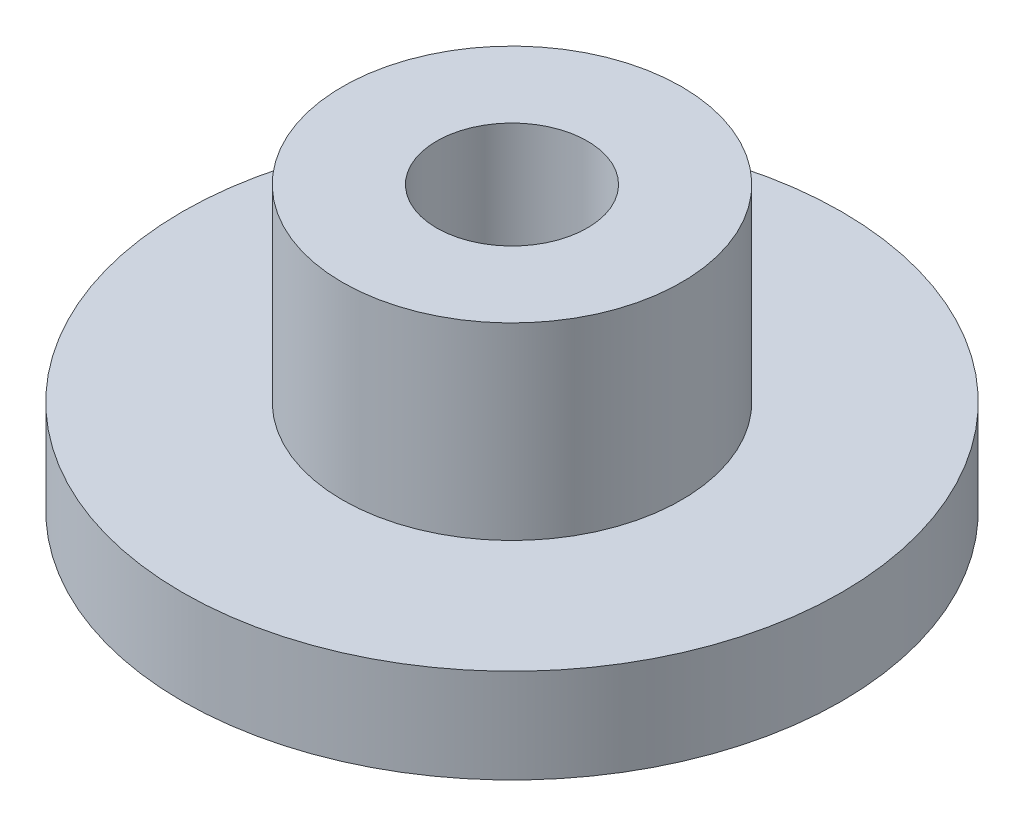
from build123d import *

# Parameters (mm, degrees)
SKETCH1_R           = 17.5
SKETCH1_R_2         = 2.5
BOSS_EXTRUDE1_DEPTH = 5
SKETCH2_R           = 9
SKETCH2_R_2         = 4
BOSS_EXTRUDE2_DEPTH = 10


with BuildPart() as part:
    # Sketch1 → Boss-Extrude1 (new body)
    with BuildSketch(Plane(origin=(0, 0, 0), x_dir=(1, 0, 0), z_dir=(0, 1, 0))):
        with Locations(Location((0, 0, 0), (0, 0, 270))):
            Circle(SKETCH1_R)
        with Locations(Location((0, 0, 0), (0, 0, 270))):
            Circle(SKETCH1_R_2, mode=Mode.SUBTRACT)
    extrude(amount=BOSS_EXTRUDE1_DEPTH)

    # Sketch2 → Boss-Extrude2 (add)
    with BuildSketch(Plane(origin=(0, 5, 0), x_dir=(1, 0, 0), z_dir=(0, 1, 0))):
        with Locations(Location((0, 0, 0), (0, 0, 270))):
            Circle(SKETCH2_R)
        with Locations(Location((0, 0, 0), (0, 0, 270))):
            Circle(SKETCH2_R_2, mode=Mode.SUBTRACT)
    extrude(amount=BOSS_EXTRUDE2_DEPTH)


solid = part.part
